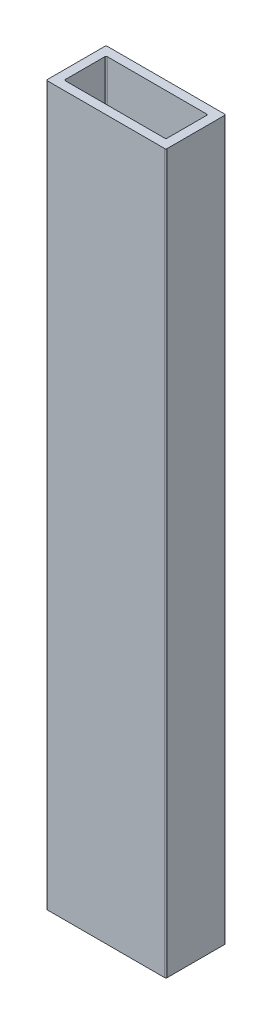
from build123d import *

# Parameters (mm, degrees)
SKETCH_1_W      = 20
SKETCH_1_H      = 10
SKETCH_1_W_2    = 17
SKETCH_1_H_2    = 7
EXTRUDE_1_DEPTH = 120
FILLET_1_R      = 0.2


with BuildPart() as part:
    # Эскиз1 → Бобышка-Вытянуть1 (new body)
    with BuildSketch(Plane(origin=(0, 0, 0), x_dir=(1, 0, 0), z_dir=(0, 1, 0))):
        Rectangle(SKETCH_1_W, SKETCH_1_H)
        Rectangle(SKETCH_1_W_2, SKETCH_1_H_2, mode=Mode.SUBTRACT)
    extrude(amount=EXTRUDE_1_DEPTH)

    # Скругление1
    fillet_1_edges = [part.edges().sort_by_distance(p)[0] for p in [
        (8.5, 60, 3.5),
        (8.5, 60, -3.5),
        (-8.5, 60, -3.5),
        (-8.5, 60, 3.5),
        (-10, 60, -5),
        (10, 60, -5),
        (10, 60, 5),
        (-10, 60, 5),
    ]]
    fillet(fillet_1_edges, radius=FILLET_1_R)


solid = part.part
